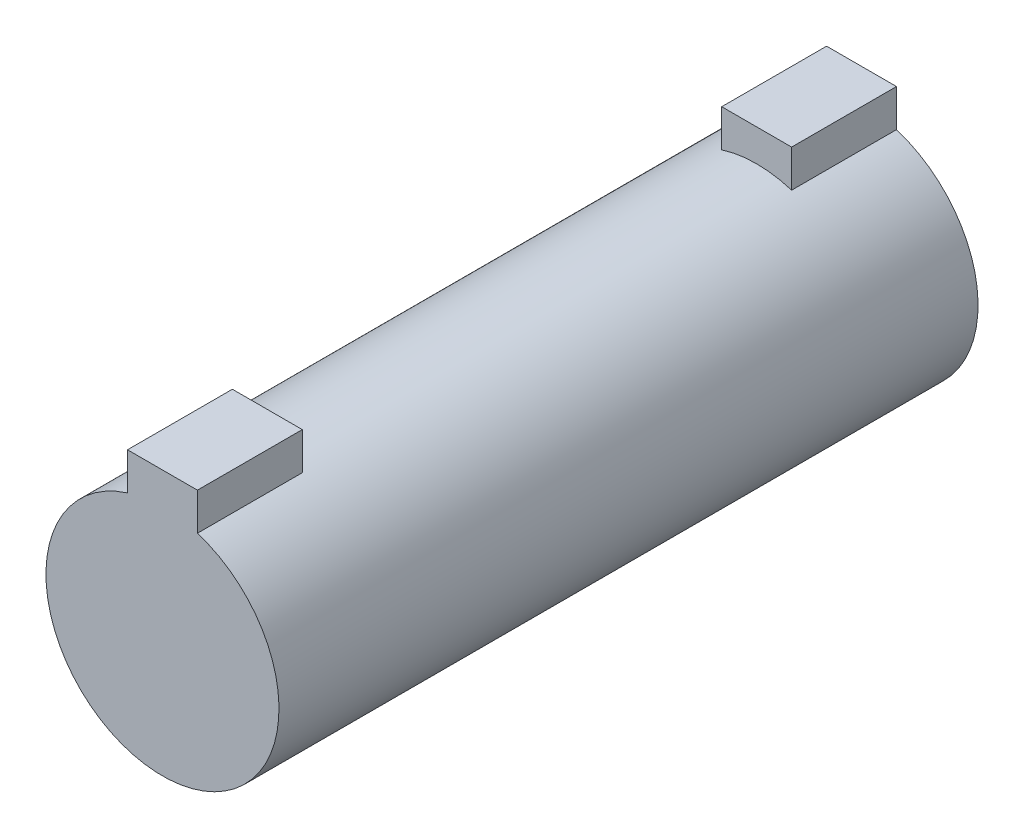
from build123d import *

# Parameters (mm, degrees)
SKETCH1_R           = 10
BOSS_EXTRUDE1_DEPTH = 30
SKETCH2_W           = 6
SKETCH2_H           = 3.26
BOSS_EXTRUDE2_DEPTH = 9


with BuildPart() as part:
    # Sketch1 → Boss-Extrude1 (new, symmetric)
    with BuildSketch(Plane.XY):
        with Locations(Location((0, 0, 0), (0, 0, 180))):
            Circle(SKETCH1_R)
    extrude(amount=BOSS_EXTRUDE1_DEPTH, both=True)

    # Sketch2 → Boss-Extrude2 (add)
    with BuildSketch(Plane.XY.offset(30)):
        with Locations((0, 11.115019423)):
            Rectangle(SKETCH2_W, SKETCH2_H)
    boss_extrude2 = extrude(amount=-BOSS_EXTRUDE2_DEPTH)

    # Mirror1: Boss-Extrude2 across plane
    add(boss_extrude2.mirror(Plane.XY))


solid = part.part
